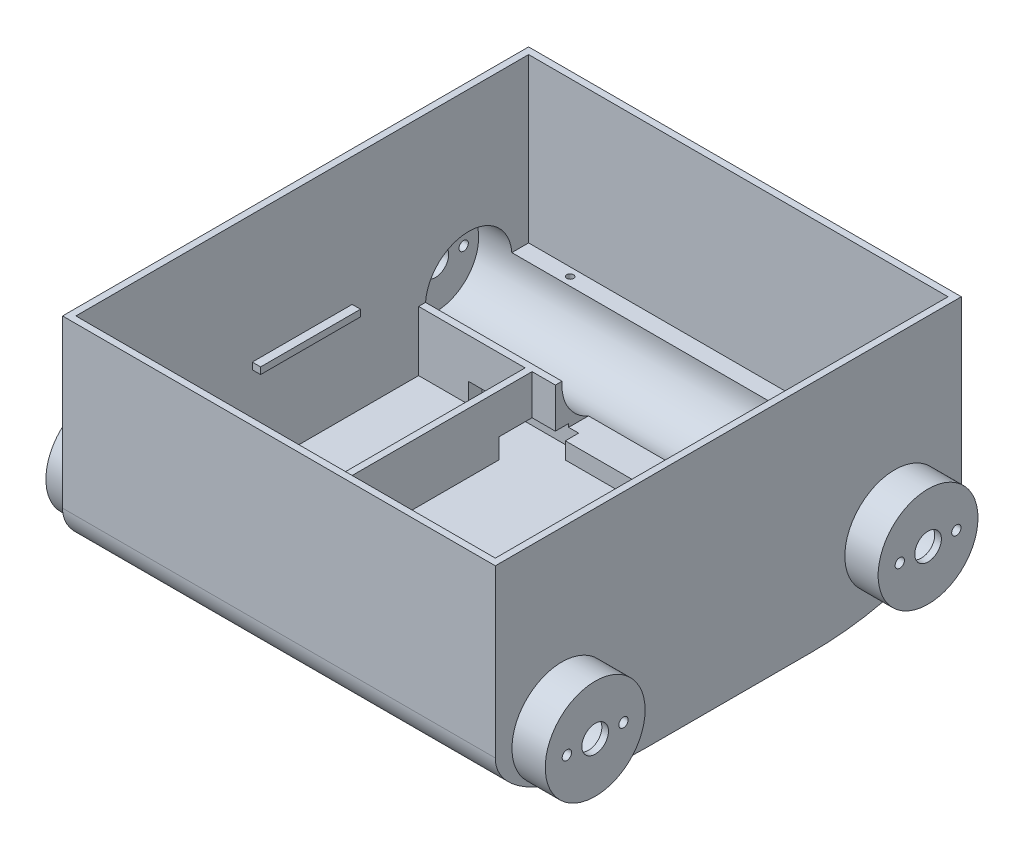
from build123d import *
from build123d.topology import SkipClean

# Parameters (mm, degrees)
EXTRUDE_1_DEPTH          = 35
EXTRUDE_1_DEPTH_BACK     = 35
SKETCH_1_W               = 130
SKETCH_1_H               = 140
CUT_EXTRUDE_1_DEPTH      = 130
SKETCH_3_W               = 126
SKETCH_3_H               = 136
CUT_EXTRUDE_2_DEPTH      = 49
CUT_EXTRUDE_3_DEPTH      = 63
CUT_EXTRUDE_3_DEPTH_BACK = 63
SKETCH_4_R               = 13
SKETCH_8_R               = 15
EXTRUDE_3_DEPTH          = 10
CUT_EXTRUDE_6_DEPTH      = 32
CUT_EXTRUDE_6_DEPTH_BACK = 160
SKETCH_7_R               = 1.4
SKETCH_7_R_2             = 4
CUT_EXTRUDE_7_DEPTH      = 136
CUT_EXTRUDE_7_DEPTH_BACK = 10
SKETCH_9_R               = 13
SKETCH_10_W              = 32
SKETCH_10_H              = 70
CUT_EXTRUDE_8_DEPTH      = 18
SKETCH_11_W              = 58
SKETCH_11_H              = 70.077037206
CUT_EXTRUDE_9_DEPTH      = 18
SKETCH_13_W              = 44
SKETCH_13_H              = 14.961481397
CUT_EXTRUDE_11_DEPTH     = 13
CUT_EXTRUDE_START        = -4
SKETCH_14_W              = 29
SKETCH_14_H              = 6
CUT_EXTRUDE_12_DEPTH     = 14
SKETCH_15_W              = 30
SKETCH_15_H              = 2
EXTRUDE_4_DEPTH          = 2.5
SKETCH_16_R              = 1
CUT_EXTRUDE_13_DEPTH     = 5
MIRROR_6_COPY_1_SKETCH_R = 1
MIRROR_6_COPY_1_DEPTH    = 5
MIRROR_6_COPY_2_SKETCH_R = 1
MIRROR_6_COPY_2_DEPTH    = 5


with BuildPart() as part:
    # Эскиз1 → Бобышка-Вытянуть1 (new, two sides: drawn at the far end of the back side and taken through both)
    with BuildSketch(Plane(origin=(0, 0, 0), x_dir=(1, 0, 0), z_dir=(0, 1, 0)).offset(-EXTRUDE_1_DEPTH_BACK)):
        Rectangle(SKETCH_1_W, SKETCH_1_H)
    extrude(amount=EXTRUDE_1_DEPTH + EXTRUDE_1_DEPTH_BACK)

    # Эскиз2 → Вырез-Вытянуть1 (cut)
    with BuildSketch(Plane(origin=(65, 0, 0), x_dir=(0, 0, -1), z_dir=(1, 0, 0))):
        with BuildLine():
            Line((-25, -35), (25, -35))
            add(Edge.make_bspline(
                [(25, -35), (70, -35), (70, -15)],
                knots=[1.570796327, 1.570796327, 1.570796327, 3.141592654, 3.141592654, 3.141592654], degree=2, weights=[1, 0.707106781, 1]))
            Line((70, -15), (70, -40.742443293))
            Line((70, -40.742443293), (-70, -40.742443293))
            Line((-70, -40.742443293), (-70, -15))
            add(Edge.make_bspline(
                [(-70, -15), (-70, -35), (-25, -35)],
                knots=[0, 0, 0, 1.570796327, 1.570796327, 1.570796327], degree=2, weights=[1, 0.707106781, 1]))
        make_face()
    extrude(amount=-CUT_EXTRUDE_1_DEPTH, mode=Mode.SUBTRACT)

    # Эскиз3 → Вырез-Вытянуть2 (cut)
    with BuildSketch(Plane(origin=(0, 35, 0), x_dir=(1, 0, 0), z_dir=(0, 1, 0))):
        Rectangle(SKETCH_3_W, SKETCH_3_H)
    extrude(amount=-CUT_EXTRUDE_2_DEPTH, mode=Mode.SUBTRACT)

    # Эскиз4 → Вырез-Вытянуть3 (cut, two sides: drawn at the far end of the back side and taken through both)
    with BuildSketch(Plane(origin=(0, 0, 0), x_dir=(0, 0, -1), z_dir=(1, 0, 0)).offset(-CUT_EXTRUDE_3_DEPTH_BACK)):
        with Locations((-50, -15)):
            Circle(SKETCH_4_R)
        with Locations((50, -15)):
            Circle(SKETCH_4_R)
    extrude(amount=CUT_EXTRUDE_3_DEPTH + CUT_EXTRUDE_3_DEPTH_BACK, mode=Mode.SUBTRACT)

    # Эскиз8 → Бобышка-Вытянуть3 (add)
    with BuildSketch(Plane(origin=(65, 0, 0), x_dir=(0, 0, -1), z_dir=(1, 0, 0))):
        with Locations((-50, -15)):
            Circle(SKETCH_8_R)
        with Locations((50, -15)):
            Circle(SKETCH_8_R)
    extrude_3 = extrude(amount=EXTRUDE_3_DEPTH)

    # Зеркальное отражение2: Бобышка-Вытянуть3 across plane
    add(extrude_3.mirror(Plane(origin=(0, 0, 0), x_dir=(0, 0, 1), z_dir=(1, 0, 0))))

    # Эскиз7 → Вырез-Вытянуть6 (cut, two sides: drawn at the far end of the back side and taken through both)
    with BuildSketch(Plane(origin=(65, 0, 0), x_dir=(0, 0, -1), z_dir=(1, 0, 0)).offset(-CUT_EXTRUDE_6_DEPTH_BACK)):
        with Locations((-58.5, -15)):
            Circle(SKETCH_7_R)
        with Locations((-50, -15)):
            Circle(SKETCH_7_R_2)
        with Locations((-41.5, -15)):
            Circle(SKETCH_7_R)
        with Locations((41.5, -15)):
            Circle(SKETCH_7_R)
        with Locations((50, -15)):
            Circle(SKETCH_7_R_2)
        with Locations((58.5, -15)):
            Circle(SKETCH_7_R)
    extrude(amount=CUT_EXTRUDE_6_DEPTH + CUT_EXTRUDE_6_DEPTH_BACK, mode=Mode.SUBTRACT)

    # Эскиз9 → Вырез-Вытянуть7 (cut, two sides: drawn at the far end of the back side and taken through both)
    with SkipClean():  # the faces are left unmerged after this step: merging them gives an invalid solid
        with BuildSketch(Plane.ZY.offset(-63).offset(-CUT_EXTRUDE_7_DEPTH_BACK)):
            with Locations((-50, -15)):
                Circle(SKETCH_9_R)
            with Locations((50, -15)):
                Circle(SKETCH_9_R)
        extrude(amount=CUT_EXTRUDE_7_DEPTH + CUT_EXTRUDE_7_DEPTH_BACK, mode=Mode.SUBTRACT)

    # Эскиз10 → Вырез-Вытянуть8 (cut)
    with SkipClean():  # the faces are left unmerged after this step: merging them gives an invalid solid
        with BuildSketch(Plane(origin=(0, -14, 0), x_dir=(1, 0, 0), z_dir=(0, 1, 0))):
            with Locations((-47, -0.038518603)):
                Rectangle(SKETCH_10_W, SKETCH_10_H)
            with Locations((47, -0.038518603)):
                Rectangle(SKETCH_10_W, SKETCH_10_H)
        extrude(amount=-CUT_EXTRUDE_8_DEPTH, mode=Mode.SUBTRACT)

    # Эскиз11 → Вырез-Вытянуть9 (cut)
    with SkipClean():  # the faces are left unmerged after this step: merging them gives an invalid solid
        with BuildSketch(Plane(origin=(0, -14, 0), x_dir=(1, 0, 0), z_dir=(0, 1, 0))):
            Rectangle(SKETCH_11_W, SKETCH_11_H)
        extrude(amount=-CUT_EXTRUDE_9_DEPTH, mode=Mode.SUBTRACT)

    # Эскиз13 → Вырез-Вытянуть11 (cut)
    with SkipClean():  # the faces are left unmerged after this step: merging them gives an invalid solid
        with BuildSketch(Plane(origin=(0, -14, 0), x_dir=(1, 0, 0), z_dir=(0, 1, 0))):
            with Locations((0, 42.519259301)):
                Rectangle(SKETCH_13_W, SKETCH_13_H)
            with Locations((0, -42.519259301)):
                Rectangle(SKETCH_13_W, SKETCH_13_H)
        extrude(amount=-CUT_EXTRUDE_11_DEPTH, mode=Mode.SUBTRACT)

    # Эскиз14 → Вырез-Вытянуть12 (cut)
    with SkipClean():  # the faces are left unmerged after this step: merging them gives an invalid solid
        with BuildSketch(Plane.XY.offset(-35.038518603).offset(CUT_EXTRUDE_START)):
            with Locations((-33.5, -29)):
                Rectangle(SKETCH_14_W, SKETCH_14_H)
        cut_extrude_12 = extrude(amount=CUT_EXTRUDE_12_DEPTH, mode=Mode.SUBTRACT)

    # Эскиз15 → Бобышка-Вытянуть4 (add)
    with BuildSketch(Plane.ZY.offset(-63)):
        with Locations((0, -4.5)):
            Rectangle(SKETCH_15_W, SKETCH_15_H)
    extrude_4 = extrude(amount=EXTRUDE_4_DEPTH)

    # Зеркальное отражение3: Бобышка-Вытянуть4 across plane
    add(extrude_4.mirror(Plane(origin=(0, 0, 0), x_dir=(0, 0, 1), z_dir=(1, 0, 0))))

    # Зеркальное отражение4: Вырез-Вытянуть12 across plane
    add(cut_extrude_12.mirror(Plane(origin=(0, 0, 0), x_dir=(0, 0, 1), z_dir=(1, 0, 0))), mode=Mode.SUBTRACT)

    # Эскиз16 → Вырез-Вытянуть13 (cut)
    with BuildSketch(Plane(origin=(0, -14, 0), x_dir=(1, 0, 0), z_dir=(0, 1, 0))):
        with Locations((-48, 65.501481397)):
            Circle(SKETCH_16_R)
    cut_extrude_13 = extrude(amount=-CUT_EXTRUDE_13_DEPTH, mode=Mode.SUBTRACT)

    # Зеркальное отражение5: Вырез-Вытянуть13 across plane
    add(cut_extrude_13.mirror(Plane.XY), mode=Mode.SUBTRACT)

    # Зеркальное отражение6 copy 1 sketch → Зеркальное отражение6 copy 1 (cut)
    with BuildSketch(Plane(origin=(0, -14, 0), x_dir=(-1, 0, 0), z_dir=(0, 1, 0))):
        with Locations((-48, 65.501481397)):
            Circle(MIRROR_6_COPY_1_SKETCH_R)
    extrude(amount=-MIRROR_6_COPY_1_DEPTH, mode=Mode.SUBTRACT)

    # Зеркальное отражение6 copy 2 sketch → Зеркальное отражение6 copy 2 (cut)
    with BuildSketch(Plane(origin=(0, -14, 0), x_dir=(-1, 0, 0), z_dir=(0, 1, 0))):
        with Locations((-48, -65.501481397)):
            Circle(MIRROR_6_COPY_2_SKETCH_R)
    extrude(amount=-MIRROR_6_COPY_2_DEPTH, mode=Mode.SUBTRACT)


solid = part.part
